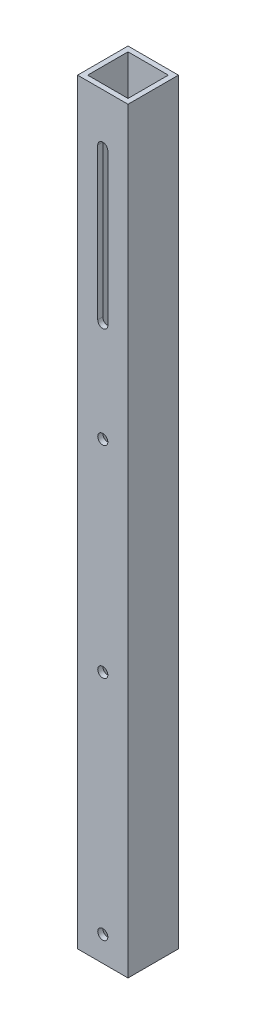
from build123d import *

# Parameters (mm, degrees)
SKETCH_1_W          = 10
SKETCH_1_H          = 10
SKETCH_1_W_2        = 6
SKETCH_1_H_2        = 6
EXTRUDE_1_DEPTH     = 150
SKETCH_2_R          = 1
CUT_EXTRUDE_1_DEPTH = 10
SKETCH_3_R          = 1
CUT_EXTRUDE_2_DEPTH = 10
SKETCH_4_R          = 1
CUT_EXTRUDE_3_DEPTH = 10
SKETCH_5_R          = 4
CUT_EXTRUDE_4_DEPTH = 150
SKETCH_6_R          = 1
CUT_EXTRUDE_5_DEPTH = 10


with BuildPart() as part:
    # 草图1 → 凸台-拉伸1 (new body)
    with BuildSketch(Plane(origin=(0, 0, 0), x_dir=(1, 0, 0), z_dir=(0, 1, 0))):
        with Locations((5, 5)):
            Rectangle(SKETCH_1_W, SKETCH_1_H)
        with Locations((5, 5)):
            Rectangle(SKETCH_1_W_2, SKETCH_1_H_2, mode=Mode.SUBTRACT)
    extrude(amount=EXTRUDE_1_DEPTH)

    # 草图2 → 切除-拉伸1 (cut)
    with BuildSketch(Plane.XY):
        with BuildLine():
            Line((4, 140), (4, 110))
            ThreePointArc((4, 110), (5, 111), (6, 110))
            Line((6, 110), (6, 140))
            ThreePointArc((6, 140), (5, 139), (4, 140))
        make_face()
        with Locations((5, 110)):
            Circle(SKETCH_2_R)
        with BuildLine():
            ThreePointArc((6, 140), (5, 141), (4, 140))
            Line((4, 140), (6, 140))
        make_face()
        with BuildLine():
            Line((6, 140), (4, 140))
            ThreePointArc((4, 140), (5, 139), (6, 140))
        make_face()
    extrude(amount=-CUT_EXTRUDE_1_DEPTH, mode=Mode.SUBTRACT)

    # 草图3 → 切除-拉伸2 (cut)
    with BuildSketch(Plane.XY):
        with Locations((5, 90)):
            Circle(SKETCH_3_R)
    extrude(amount=-CUT_EXTRUDE_2_DEPTH, mode=Mode.SUBTRACT)

    # 草图4 → 切除-拉伸3 (cut)
    with BuildSketch(Plane(origin=(0, 0, -10), x_dir=(-1, 0, 0), z_dir=(0, 0, -1))):
        with Locations((-5, 5)):
            Circle(SKETCH_4_R)
    extrude(amount=-CUT_EXTRUDE_3_DEPTH, mode=Mode.SUBTRACT)

    # 草图5 → 切除-拉伸4 (cut)
    with BuildSketch(Plane(origin=(0, 0, 0), x_dir=(1, 0, 0), z_dir=(0, 1, 0))):
        with BuildLine():
            Line((1, 9), (1, 5))
            ThreePointArc((1, 5), (2.171572875, 7.828427125), (5, 9))
            Line((5, 9), (1, 9))
        make_face()
        with Locations((5, 5)):
            Circle(SKETCH_5_R)
        with BuildLine():
            ThreePointArc((5, 1), (2.171572875, 2.171572875), (1, 5))
            Line((1, 5), (1, 1))
            Line((1, 1), (5, 1))
        make_face()
        with BuildLine():
            Line((9, 9), (5, 9))
            ThreePointArc((5, 9), (7.828427125, 7.828427125), (9, 5))
            Line((9, 5), (9, 9))
        make_face()
        with BuildLine():
            ThreePointArc((9, 5), (7.828427125, 2.171572875), (5, 1))
            Line((5, 1), (9, 1))
            Line((9, 1), (9, 5))
        make_face()
    extrude(amount=CUT_EXTRUDE_4_DEPTH, mode=Mode.SUBTRACT)

    # 草图6 → 切除-拉伸5 (cut)
    with BuildSketch(Plane(origin=(0, 0, -10), x_dir=(-1, 0, 0), z_dir=(0, 0, -1))):
        with Locations((-5, 50)):
            Circle(SKETCH_6_R)
    extrude(amount=-CUT_EXTRUDE_5_DEPTH, mode=Mode.SUBTRACT)


solid = part.part
